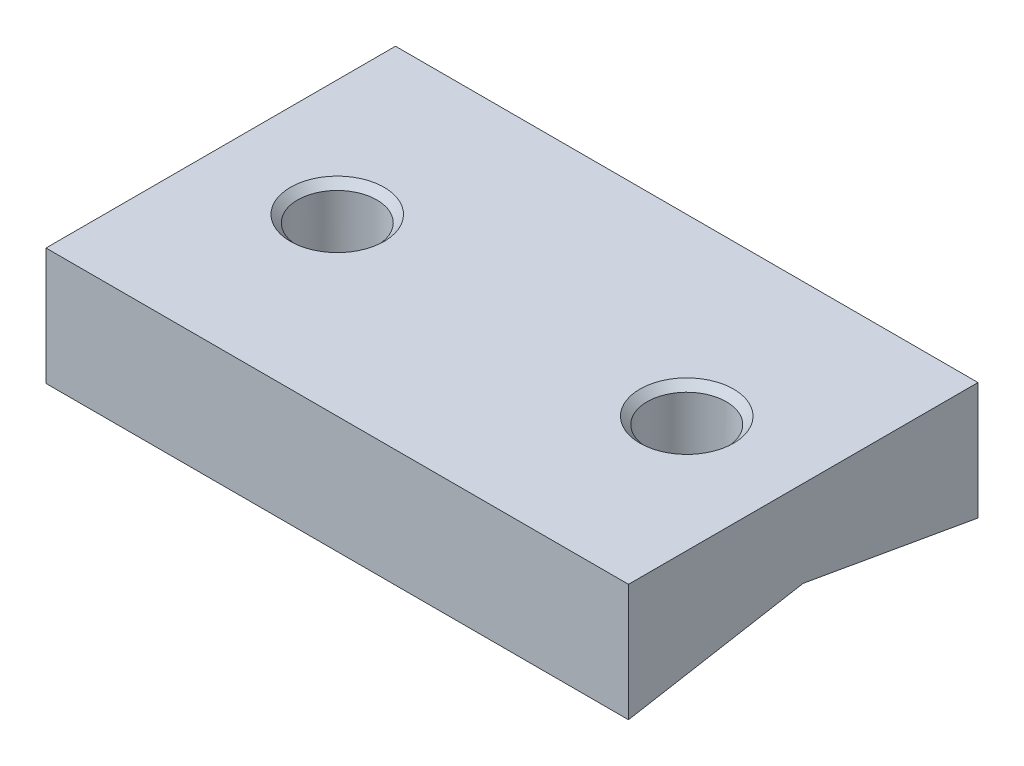
from build123d import *

# Parameters (mm, degrees)
SKETCH_2_W                  = 50
SKETCH_2_H                  = 30
EXTRUDE_1_DEPTH             = 6
HOLE_WIZARD_M81_D           = 6.8
HOLE_WIZARD_M81_CSINK_D     = 8.05
HOLE_WIZARD_M81_CSINK_ANGLE = 90
CUT_EXTRUDE_1_DEPTH         = 115.764977236
CUT_EXTRUDE_1_DEPTH_BACK    = 115.764977236


with BuildPart() as part:
    # Эскиз2 → Бобышка-Вытянуть1 (new, symmetric)
    with BuildSketch(Plane(origin=(0, 105, 0), x_dir=(1, 0, 0), z_dir=(0, 1, 0))):
        Rectangle(SKETCH_2_W, SKETCH_2_H)
    extrude(amount=EXTRUDE_1_DEPTH, both=True)

    # Отверстие обработанное метчиком M81 (through all)
    with Locations(Plane(origin=(0, 111, 0), x_dir=(1, 0, 0), z_dir=(0, 1, 0))):
        with Locations((15, 0), (-15, 0)):
            CounterSinkHole(HOLE_WIZARD_M81_D / 2, HOLE_WIZARD_M81_CSINK_D / 2, counter_sink_angle=HOLE_WIZARD_M81_CSINK_ANGLE)

    # Эскиз5 → Вырез-Вытянуть1 (cut, two sides: drawn at the far end of the back side and taken through both)
    with BuildSketch(Plane(origin=(0, 0, 0), x_dir=(0, 0, -1), z_dir=(1, 0, 0)).offset(-CUT_EXTRUDE_1_DEPTH_BACK)):
        Polygon((-34.027690918, 97.573514412), (0, 103.573514412), (34.027690918, 97.573514412), align=None)
    extrude(amount=CUT_EXTRUDE_1_DEPTH + CUT_EXTRUDE_1_DEPTH_BACK, mode=Mode.SUBTRACT)


solid = part.part
